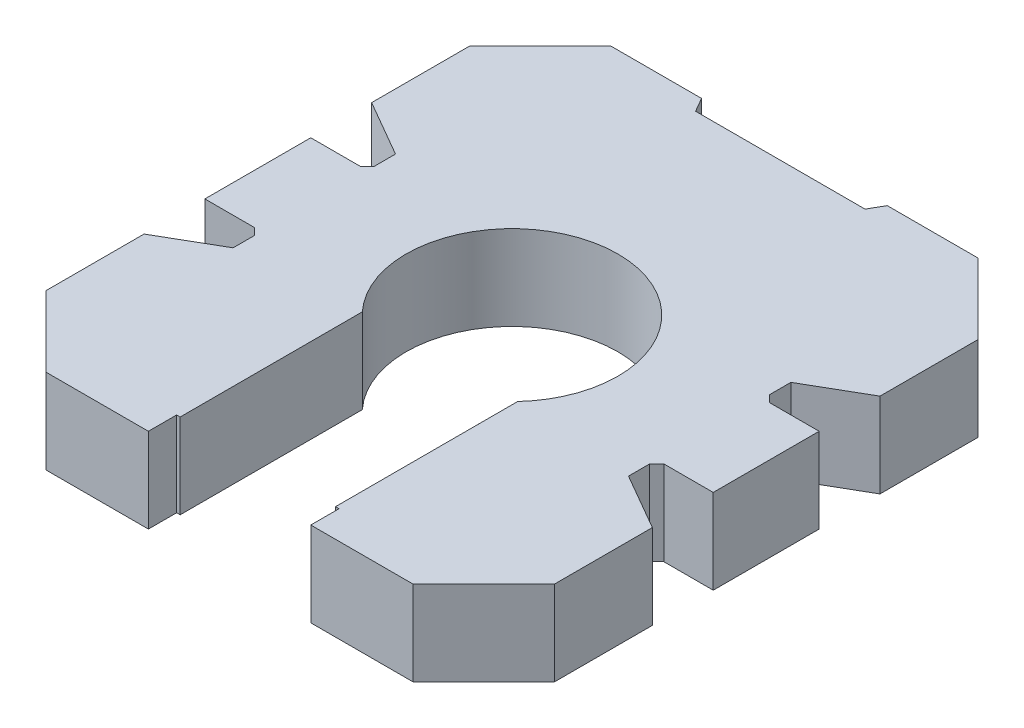
from build123d import *

# Parameters (mm, degrees)
SKETCH_1_W          = 360
SKETCH_1_H          = 400
EXTRUDE_1_DEPTH     = 60
CHAMFER_1_SIZE      = 50
SKETCH_2_W          = 40
SKETCH_2_H          = 115
CUT_EXTRUDE_1_DEPTH = 276.680975042
CUT_EXTRUDE_2_DEPTH = 60
SKETCH_4_W          = 110
SKETCH_4_H          = 95
SKETCH_4_H_2        = 20
SKETCH_4_W_2        = 2.5
CUT_EXTRUDE_3_DEPTH = 276.680975042
SKETCH_5_W          = 40
SKETCH_5_H          = 75
EXTRUDE_2_DEPTH     = 60
CUT_EXTRUDE_4_DEPTH = 60
SKETCH_7_R          = 75
CUT_EXTRUDE_5_DEPTH = 60
CUT_EXTRUDE_6_DEPTH = 60
CHAMFER_2_SIZE      = 5


with BuildPart() as part:
    # 草图1 → 凸台-拉伸1 (new body)
    with BuildSketch(Plane(origin=(0, 0, 0), x_dir=(1, 0, 0), z_dir=(0, 1, 0))):
        Rectangle(SKETCH_1_W, SKETCH_1_H)
    extrude(amount=EXTRUDE_1_DEPTH)

    # 倒角1
    chamfer_1_edges = [part.edges().sort_by_distance(p)[0] for p in [
        (180, 30, 200),
        (-180, 30, 200),
        (-180, 30, -200),
        (180, 30, -200),
    ]]
    chamfer(chamfer_1_edges, length=CHAMFER_1_SIZE)

    # 草图2 → 切除-拉伸1 (cut, through all)
    with BuildSketch(Plane(origin=(0, 60, 0), x_dir=(1, 0, 0), z_dir=(0, 1, 0))):
        with Locations((-160, 0)):
            Rectangle(SKETCH_2_W, SKETCH_2_H)
        with Locations((160, 0)):
            Rectangle(SKETCH_2_W, SKETCH_2_H)
    extrude(amount=-CUT_EXTRUDE_1_DEPTH, mode=Mode.SUBTRACT)

    # 草图3 → 切除-拉伸2 (cut)
    with BuildSketch(Plane(origin=(0, 60, 0), x_dir=(1, 0, 0), z_dir=(0, 1, 0))):
        Polygon((-140, -57.5), (-180, -57.5), (-180, -80.594010768), align=None)
        Polygon((-180, 80.594010768), (-140, 57.5), (-180, 57.5), align=None)
        Polygon((140, 57.5), (180, 57.5), (180, 80.594010768), align=None)
        Polygon((180, -80.594010768), (140, -57.5), (180, -57.5), align=None)
    extrude(amount=-CUT_EXTRUDE_2_DEPTH, mode=Mode.SUBTRACT)

    # 草图4 → 切除-拉伸3 (cut, through all)
    with BuildSketch(Plane(origin=(0, 0, 0), x_dir=(1, 0, 0), z_dir=(0, 1, 0))):
        with Locations((0, -132.5)):
            Rectangle(SKETCH_4_W, SKETCH_4_H)
        with Locations((0, -190)):
            Rectangle(SKETCH_4_W, SKETCH_4_H_2)
        with Locations((-56.25, -190)):
            Rectangle(SKETCH_4_W_2, SKETCH_4_H_2)
        with Locations((56.25, -190)):
            Rectangle(SKETCH_4_W_2, SKETCH_4_H_2)
    extrude(amount=CUT_EXTRUDE_3_DEPTH, mode=Mode.SUBTRACT)

    # 草图5 → 凸台-拉伸2 (add)
    with BuildSketch(Plane(origin=(0, 60, 0), x_dir=(1, 0, 0), z_dir=(0, 1, 0))):
        with Locations((-160, 0)):
            Rectangle(SKETCH_5_W, SKETCH_5_H)
        with Locations((160, 0)):
            Rectangle(SKETCH_5_W, SKETCH_5_H)
    extrude(amount=-EXTRUDE_2_DEPTH)

    # 草图6 → 切除-拉伸4 (cut)
    with BuildSketch(Plane(origin=(0, 60, 0), x_dir=(1, 0, 0), z_dir=(0, 1, 0))):
        Polygon((-65.773502692, 200), (-60, 190), (60, 190), (65.773502692, 200), align=None)
    extrude(amount=-CUT_EXTRUDE_4_DEPTH, mode=Mode.SUBTRACT)

    # 草图7 → 切除-拉伸5 (cut)
    with BuildSketch(Plane(origin=(0, 60, 0), x_dir=(1, 0, 0), z_dir=(0, 1, 0))):
        with Locations(Location((0, 0, 0), (0, 0, 270))):
            Circle(SKETCH_7_R)
    extrude(amount=-CUT_EXTRUDE_5_DEPTH, mode=Mode.SUBTRACT)

    # 草图8 → 切除-拉伸6 (cut)
    with BuildSketch(Plane(origin=(0, 60, 0), x_dir=(1, 0, 0), z_dir=(0, 1, 0))):
        with BuildLine():
            Line((-55, -85), (-55, -50.990195136))
            ThreePointArc((-55, -50.990195136), (0, -75), (55, -50.990195136))
            Line((55, -50.990195136), (55, -85))
            Line((55, -85), (-55, -85))
        make_face()
    extrude(amount=-CUT_EXTRUDE_6_DEPTH, mode=Mode.SUBTRACT)

    # 倒角2
    chamfer_2_edges = [part.edges().sort_by_distance(p)[0] for p in [
        (-140, 30, -37.5),
        (-140, 30, 37.5),
        (140, 30, 37.5),
        (140, 30, -37.5),
    ]]
    chamfer(chamfer_2_edges, length=CHAMFER_2_SIZE)


solid = part.part
